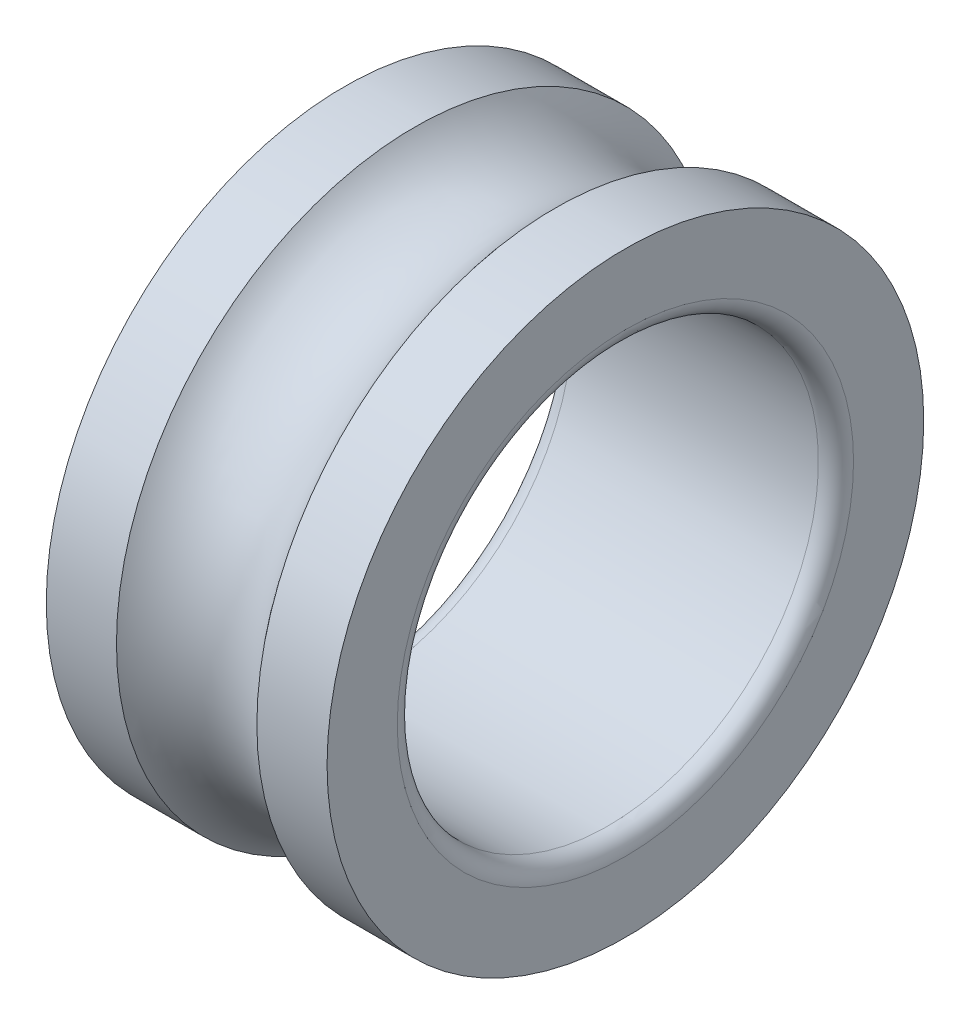
from build123d import *


with BuildPart() as part:
    # Esquisse1 → Base-Révolution (revolve)
    with BuildSketch(Plane.XY, mode=Mode.PRIVATE) as base_r_volution_sk:
        with BuildLine():
            Line((6, 8.5), (8, 8.5))
            Line((8, 8.5), (8, 6.5))
            ThreePointArc((8, 6.5), (7.853553391, 6.146446609), (7.5, 6))
            Line((7.5, 6), (0.5, 6))
            ThreePointArc((0.5, 6), (0.146446609, 6.146446609), (0, 6.5))
            Line((0, 6.5), (0, 8.5))
            Line((0, 8.5), (2, 8.5))
            ThreePointArc((2, 8.5), (4, 7.5), (6, 8.5))
        make_face()
    revolve(base_r_volution_sk.sketch.rotate(Axis((0, 0, 0), (1, 0, 0)), 90), axis=Axis((0, 0, 0), (1, 0, 0)))


solid = part.part
